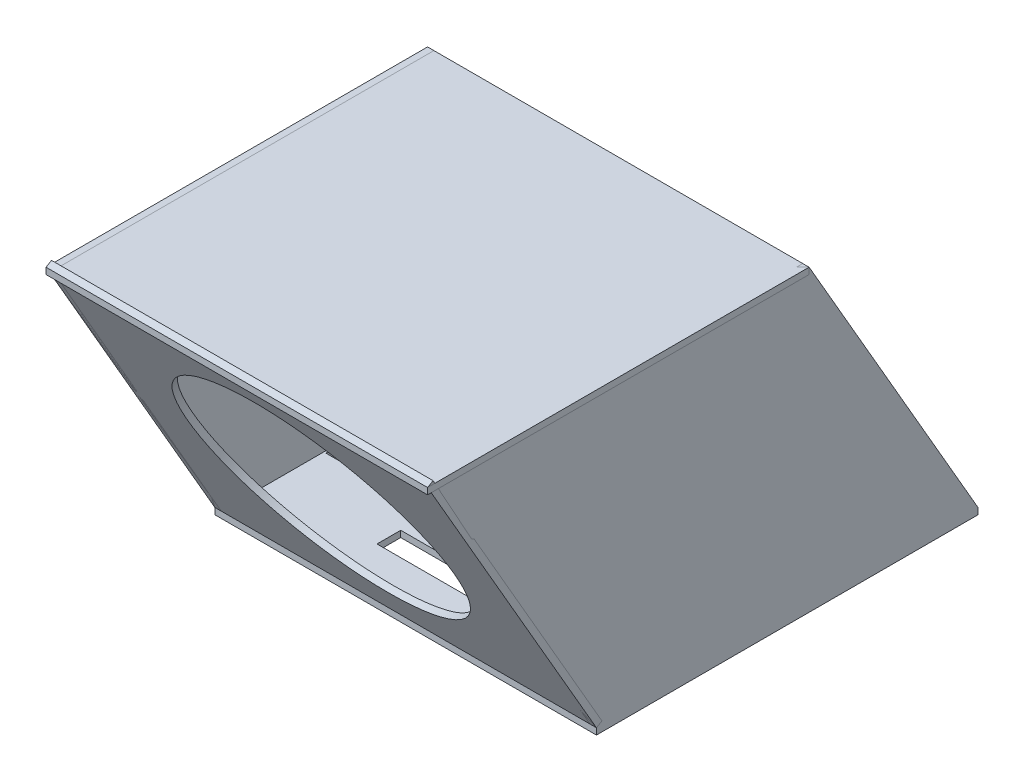
from build123d import *

# Parameters (mm, degrees)
SKETCH1_W           = 60
SKETCH1_H           = 60
BOSS_EXTRUDE1_DEPTH = 1
BOSS_EXTRUDE2_DEPTH = 1
BOSS_EXTRUDE3_DEPTH = 1
SKETCH5_W           = 59
SKETCH5_H           = 53.982250169
BOSS_EXTRUDE4_DEPTH = 1
SKETCH6_W           = 24.567934446
SKETCH6_H           = 3.734541331
SKETCH6_W_2         = 3.411160388
SKETCH6_H_2         = 27.754766174
CUT_EXTRUDE2_DEPTH  = 1
SKETCH9_R           = 21
CUT_EXTRUDE3_DEPTH  = 1
SKETCH13_W          = 60
SKETCH13_H          = 53.116224765
BOSS_EXTRUDE6_DEPTH = 1
SKETCH14_R          = 21
CUT_EXTRUDE4_DEPTH  = 1
SKETCH15_W          = 60
SKETCH15_H          = 60
BOSS_EXTRUDE7_DEPTH = 1


with BuildPart() as part:
    # Sketch1 → Boss-Extrude1 (new body)
    with BuildSketch(Plane(origin=(0, 0, 0), x_dir=(1, 0, 0), z_dir=(0, 1, 0))):
        Rectangle(SKETCH1_W, SKETCH1_H)
    extrude(amount=BOSS_EXTRUDE1_DEPTH)

    # Sketch2 → Boss-Extrude2 (add)
    with BuildSketch(Plane.ZY.offset(30)):
        Polygon((-30, 1), (30, 1), (56.558112383, 47), (-3.441887617, 47), align=None)
    extrude(amount=-BOSS_EXTRUDE2_DEPTH)

    # Sketch3 → Boss-Extrude3 (add)
    with BuildSketch(Plane(origin=(30, 0, 0), x_dir=(0, 0, -1), z_dir=(1, 0, 0))):
        Polygon((30, 1), (-30, 1), (-56.558112383, 47), (3.441887617, 47), align=None)
    extrude(amount=-BOSS_EXTRUDE3_DEPTH)

    # Sketch5 → Boss-Extrude4 (add)
    with BuildSketch(Plane(origin=(0, 13.240381057, -22.933012702), x_dir=(-1, 0, 0), z_dir=(0, 0.500000000000001, -0.8660254037844382))):
        with Locations((0.5, 11.991125085)):
            Rectangle(SKETCH5_W, SKETCH5_H)
    extrude(amount=-BOSS_EXTRUDE4_DEPTH)

    # Sketch6 → Cut-Extrude2 (cut)
    with BuildSketch(Plane.XZ):
        with Locations((0, 20.357331474)):
            Rectangle(SKETCH6_W, SKETCH6_H)
        with Locations((0, -20.357331474)):
            Rectangle(SKETCH6_W, SKETCH6_H)
        with Locations((26.960745132, 0)):
            Rectangle(SKETCH6_W_2, SKETCH6_H_2)
        with Locations((-26.960745132, 0)):
            Rectangle(SKETCH6_W_2, SKETCH6_H_2)
    extrude(amount=-CUT_EXTRUDE2_DEPTH, mode=Mode.SUBTRACT)

    # Sketch9 → Cut-Extrude3 (cut)
    with BuildSketch(Plane(origin=(0, 13.240381057, -22.933012702), x_dir=(-1, 0, 0), z_dir=(0, 0.500000000000001, -0.8660254037844382))):
        with Locations(Location((0, 12.207631436, 0), (0, 0, 90))):
            Circle(SKETCH9_R)
    extrude(amount=-CUT_EXTRUDE3_DEPTH, mode=Mode.SUBTRACT)


with BuildPart() as body_2:
    # Sketch13 → Boss-Extrude6 (new body)
    with BuildSketch(Plane(origin=(0, -12.740381057, 22.066987298), x_dir=(1, 0, 0), z_dir=(0, -0.500000000000001, 0.8660254037844382))):
        with Locations((0, 42.424137787)):
            Rectangle(SKETCH13_W, SKETCH13_H)
    extrude(amount=-BOSS_EXTRUDE6_DEPTH)

    # Sketch14 → Cut-Extrude4 (cut)
    with BuildSketch(Plane(origin=(0, -12.740381057, 22.066987298), x_dir=(1, 0, 0), z_dir=(0, -0.500000000000001, 0.8660254037844382))):
        with Locations(Location((0, 42.424137787, 0), (0, 0, 270))):
            Circle(SKETCH14_R)
    extrude(amount=-CUT_EXTRUDE4_DEPTH, mode=Mode.SUBTRACT)


with BuildPart() as body_3:
    # Sketch15 → Boss-Extrude7 (new body)
    with BuildSketch(Plane(origin=(0, 47, 0), x_dir=(1, 0, 0), z_dir=(0, 1, 0))):
        with Locations((0, -26.558112383)):
            Rectangle(SKETCH15_W, SKETCH15_H)
    extrude(amount=-BOSS_EXTRUDE7_DEPTH)


solid = Compound([part.part, body_2.part, body_3.part])
